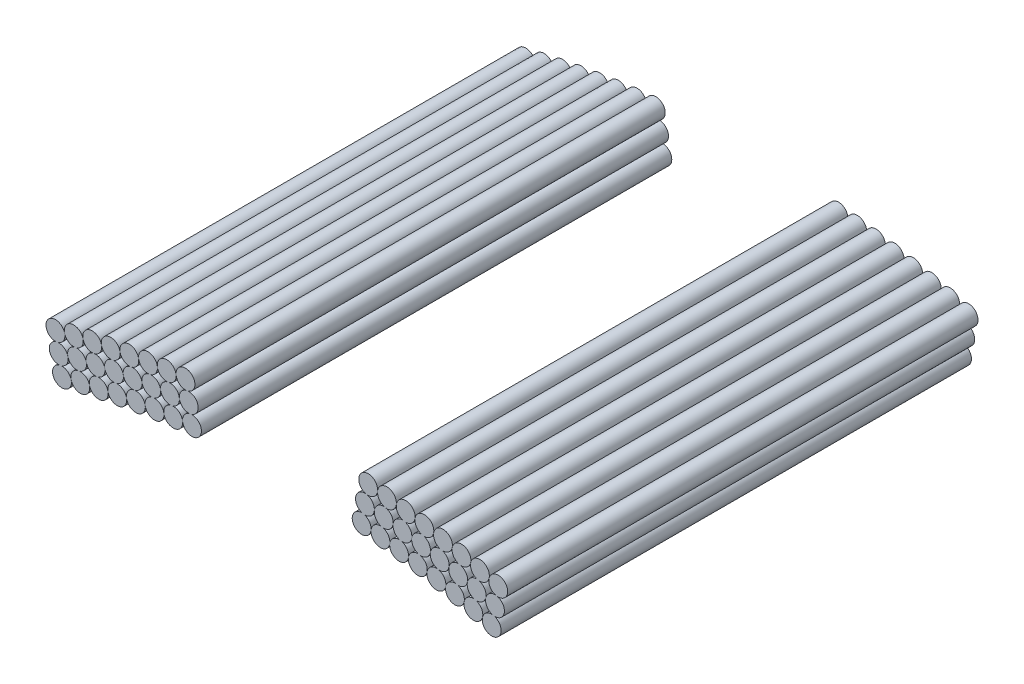
from build123d import *

# Parameters (mm, degrees)
BOSS_EXTRUDE1_DEPTH   = 25.4
SKETCH1_R             = 0.509820421
BOSS_EXTRUDE1_2_DEPTH = 25.4
BOSS_EXTRUDE1_3_DEPTH = 25.4
BOSS_EXTRUDE1_4_DEPTH = 25.4
BOSS_EXTRUDE1_5_DEPTH = 25.4
BOSS_EXTRUDE1_6_DEPTH = 25.4
BOSS_EXTRUDE1_7_DEPTH = 25.4
BOSS_EXTRUDE1_8_DEPTH = 25.4
LPATTERN1_COUNT       = 3
LPATTERN1_PITCH       = 1.016


with BuildPart() as part:
    # Sketch1 → Boss-Extrude1 (new body)
    with BuildSketch(Plane.XY):
        with BuildLine():
            ThreePointArc((-11.108259637, 45.395710289), (-10.497281522, 45.02038499), (-10.115313956, 45.627232677))
            ThreePointArc((-10.115313956, 45.627232677), (-10.728817685, 46.01338975), (-11.108259637, 45.395710289))
        make_face()
    boss_extrude1 = extrude(amount=-BOSS_EXTRUDE1_DEPTH)


with BuildPart() as body_2:
    # Sketch1 → Boss-Extrude1 2 (new body)
    with BuildSketch(Plane.XY):
        with Locations((-11.60346965, 45.274533126)):
            Circle(SKETCH1_R)
    boss_extrude1_2 = extrude(amount=-BOSS_EXTRUDE1_2_DEPTH)


with BuildPart() as body_3:
    # Sketch1 → Boss-Extrude1 3 (new body)
    with BuildSketch(Plane.XY):
        with Locations((-4.581107503, 46.512765041)):
            Circle(SKETCH1_R)
    boss_extrude1_3 = extrude(amount=-BOSS_EXTRUDE1_3_DEPTH)


with BuildPart() as body_4:
    # Sketch1 → Boss-Extrude1 4 (new body)
    with BuildSketch(Plane.XY):
        with BuildLine():
            ThreePointArc((-5.08789772, 46.457262448), (-5.655715279, 46.907914576), (-6.100146787, 46.335215042))
            ThreePointArc((-6.100146787, 46.335215042), (-5.533660612, 45.895605282), (-5.08789772, 46.457262448))
        make_face()
    boss_extrude1_4 = extrude(amount=-BOSS_EXTRUDE1_4_DEPTH)


with BuildPart() as body_5:
    # Sketch1 → Boss-Extrude1 5 (new body)
    with BuildSketch(Plane.XY):
        with BuildLine():
            ThreePointArc((-6.100146787, 46.335215042), (-6.677660191, 46.773372976), (-7.1094925, 46.191114473))
            ThreePointArc((-7.1094925, 46.191114473), (-6.533551048, 45.763967209), (-6.100146787, 46.335215042))
        make_face()
    boss_extrude1_5 = extrude(amount=-BOSS_EXTRUDE1_5_DEPTH)


with BuildPart() as body_6:
    # Sketch1 → Boss-Extrude1 6 (new body)
    with BuildSketch(Plane.XY):
        with BuildLine():
            ThreePointArc((-7.1094925, 46.191114473), (-7.696426832, 46.616569793), (-8.115454481, 46.025029456))
            ThreePointArc((-8.115454481, 46.025029456), (-7.530331934, 45.610547957), (-7.1094925, 46.191114473))
        make_face()
    boss_extrude1_6 = extrude(amount=-BOSS_EXTRUDE1_6_DEPTH)


with BuildPart() as body_7:
    # Sketch1 → Boss-Extrude1 7 (new body)
    with BuildSketch(Plane.XY):
        with BuildLine():
            ThreePointArc((-8.115454481, 46.025029456), (-8.711530349, 46.437579655), (-9.117553966, 45.837039124))
            ThreePointArc((-9.117553966, 45.837039124), (-8.523528831, 45.435420547), (-8.115454481, 46.025029456))
        make_face()
    boss_extrude1_7 = extrude(amount=-BOSS_EXTRUDE1_7_DEPTH)


with BuildPart() as body_8:
    # Sketch1 → Boss-Extrude1 8 (new body)
    with BuildSketch(Plane.XY):
        with BuildLine():
            ThreePointArc((-9.117553966, 45.837039124), (-9.722487785, 46.236487718), (-10.115313956, 45.627232677))
            ThreePointArc((-10.115313956, 45.627232677), (-9.512668855, 45.238668363), (-9.117553966, 45.837039124))
        make_face()
    boss_extrude1_8 = extrude(amount=-BOSS_EXTRUDE1_8_DEPTH)


with BuildPart() as part_1:
    add(part.part)

    add(body_2.part)  # LPattern1 merges body 2

    add(body_3.part)  # LPattern1 merges body 3

    add(body_4.part)  # LPattern1 merges body 4

    add(body_5.part)  # LPattern1 merges body 5

    add(body_6.part)  # LPattern1 merges body 6

    add(body_7.part)  # LPattern1 merges body 7

    add(body_8.part)  # LPattern1 merges body 8
    # LPattern1: Boss-Extrude1, Boss-Extrude1 2, Boss-Extrude1 3, Boss-Extrude1 4, Boss-Extrude1 5, Boss-Extrude1 6, Boss-Extrude1 7, Boss-Extrude1 8 ×3
    with Locations(*[Vector(-0.17364817766693402, 0.9848077530122075, 0) * (i * LPATTERN1_PITCH) for i in range(1, LPATTERN1_COUNT)]):
        add(boss_extrude1)
        add(boss_extrude1_2)
        add(boss_extrude1_3)
        add(boss_extrude1_4)
        add(boss_extrude1_5)
        add(boss_extrude1_6)
        add(boss_extrude1_7)
        add(boss_extrude1_8)


with BuildPart() as body_2_2:
    # Mirror1: mirrored copy
    add(part_1.part.mirror(Plane(origin=(0, 0, 0), x_dir=(0, 0, 1), z_dir=(1, 0, 0))))


solid = Compound([part_1.part, body_2_2.part])
